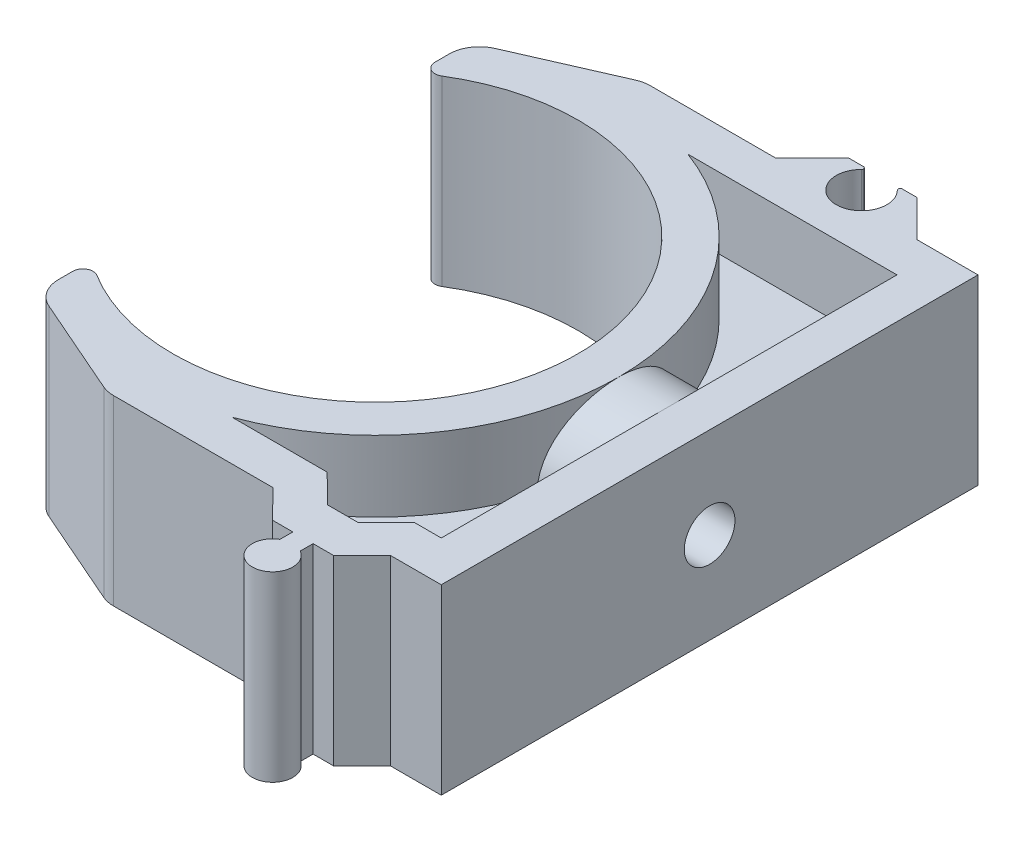
from build123d import *

# Parameters (mm, degrees)
BOSS_EXTRUDE1_DEPTH = 18
CUT_EXTRUDE1_DEPTH  = 7
BOSS_EXTRUDE2_DEPTH = 7
SKETCH4_R           = 2.5
CUT_EXTRUDE2_DEPTH  = 6
SKETCH5_R           = 5.75
CUT_EXTRUDE3_DEPTH  = 7
CUT_EXTRUDE4_START  = -7
SKETCH6_R           = 5.75
CUT_EXTRUDE4_DEPTH  = 7


with BuildPart() as part:
    # Sketch1 → Boss-Extrude1 (new body)
    with BuildSketch(Plane(origin=(0, 0, 0), x_dir=(1, 0, 0), z_dir=(0, 1, 0))):
        with BuildLine():
            Line((10.653013329, -29.309744988), (10.653013329, -30.57769418))
            ThreePointArc((10.653013329, -30.57769418), (11.653013329, -34.309744988), (12.653013329, -30.57769418))
            Line((12.653013329, -30.57769418), (12.653013329, -29.309744988))
            Line((12.653013329, -29.309744988), (14.653013329, -29.309744988))
            Line((14.653013329, -29.309744988), (17.5, -26.5))
            Line((17.5, -26.5), (22.5, -26.5))
            Line((22.5, -26.5), (22.5, 26.5))
            Line((22.5, 26.5), (16.5, 26.5))
            Line((16.5, 26.5), (12.844502727, 30.107679392))
            Line((12.844502727, 30.107679392), (11.410696035, 30.107679392))
            ThreePointArc((11.410696035, 30.107679392), (11.225950376, 29.984289062), (11.269162996, 29.766369807))
            ThreePointArc((11.269162996, 29.766369807), (9.5, 25.5), (7.730837004, 29.766369807))
            ThreePointArc((7.730837004, 29.766369807), (7.774049624, 29.984289062), (7.589303965, 30.107679392))
            Line((7.589303965, 30.107679392), (6.155497273, 30.107679392))
            Line((6.155497273, 30.107679392), (2.5, 26.5))
            Line((2.5, 26.5), (-9.870833143, 26.5))
            ThreePointArc((-9.870833143, 26.5), (-10.486603861, 26.436124388), (-11.076152757, 26.247217616))
            Line((-11.076152757, 26.247217616), (-20.702456422, 22.023754373))
            Line((-20.702456422, 22.023754373), (-20.705319614, 22.022498171))
            ThreePointArc((-20.705319614, 22.022498171), (-22.011569115, 20.916018371), (-22.5, 19.275280555))
            Line((-22.5, 19.275280555), (-22.5, 17.88854382))
            ThreePointArc((-22.5, 17.88854382), (-21.987950036, 17.015672259), (-20.976190476, 17.0367084))
            ThreePointArc((-20.976190476, 17.0367084), (9.5, 0), (-20.976190476, -17.0367084))
            ThreePointArc((-20.976190476, -17.0367084), (-21.987950036, -17.015672259), (-22.5, -17.88854382))
            Line((-22.5, -17.88854382), (-22.5, -19.287953276))
            ThreePointArc((-22.5, -19.287953276), (-22.010713993, -20.929999331), (-20.702456502, -22.03642528))
            Line((-20.702456502, -22.03642528), (-11.074921132, -26.248472005))
            ThreePointArc((-11.074921132, -26.248472005), (-10.486705619, -26.43644479), (-9.87246463, -26.5))
            Line((-9.87246463, -26.5), (5.880022863, -26.5))
            Line((5.880022863, -26.5), (8.653013329, -29.309744988))
            Line((8.653013329, -29.309744988), (10.653013329, -29.309744988))
        make_face()
    extrude(amount=BOSS_EXTRUDE1_DEPTH)

    # Sketch2 → Cut-Extrude1 (cut)
    with BuildSketch(Plane.XZ):
        with BuildLine():
            Line((18.5, 22.5), (18.5, -22.5))
            Line((18.5, -22.5), (-2.148353456, -22.5))
            ThreePointArc((-2.148353456, -22.5), (13.5, 0), (-2.148353456, 22.5))
            Line((-2.148353456, 22.5), (7.238559187, 22.5))
            Line((7.238559187, 22.5), (10.039345887, 25.282038261))
            Line((10.039345887, 25.282038261), (13.039345883, 25.282178795))
            Line((13.039345883, 25.282178795), (15.843268341, 22.5))
            Line((15.843268341, 22.5), (18.5, 22.5))
        make_face()
    cut_extrude1 = extrude(amount=-CUT_EXTRUDE1_DEPTH, mode=Mode.SUBTRACT)

    # Mirror1: Cut-Extrude1 across plane
    add(cut_extrude1.mirror(Plane(origin=(0, 9, 0), x_dir=(0, 0, 1), z_dir=(0, -1, 0))), mode=Mode.SUBTRACT)

    # Sketch3 → Boss-Extrude2 (add)
    with BuildSketch(Plane.ZY.offset(-18.5)):
        with BuildLine():
            Line((7, 7), (-7, 7))
            ThreePointArc((-7, 7), (0, 0), (7, 7))
        make_face()
    boss_extrude2 = extrude(amount=BOSS_EXTRUDE2_DEPTH)

    # Mirror2: Boss-Extrude2 across plane
    add(boss_extrude2.mirror(Plane(origin=(0, 9, 0), x_dir=(0, 0, 1), z_dir=(0, -1, 0))))

    # Sketch4 → Cut-Extrude2 (cut)
    with BuildSketch(Plane(origin=(22.5, 0, 0), x_dir=(0, 0, -1), z_dir=(1, 0, 0))):
        with Locations((0, 9)):
            Circle(SKETCH4_R)
    extrude(amount=-CUT_EXTRUDE2_DEPTH, mode=Mode.SUBTRACT)

    # Sketch5 → Cut-Extrude3 (cut)
    with BuildSketch(Plane(origin=(9.5, 0, 0), x_dir=(0, 0, -1), z_dir=(1, 0, 0))):
        with Locations((0, 9)):
            Circle(SKETCH5_R)
    extrude(amount=-CUT_EXTRUDE3_DEPTH, mode=Mode.SUBTRACT)

    # Sketch6 → Cut-Extrude4 (cut)
    with BuildSketch(Plane.ZY.offset(-9.5).offset(CUT_EXTRUDE4_START)):
        with Locations(Location((0, 9, 0), (0, 0, 180))):
            Circle(SKETCH6_R)
    extrude(amount=CUT_EXTRUDE4_DEPTH, mode=Mode.SUBTRACT)


solid = part.part
